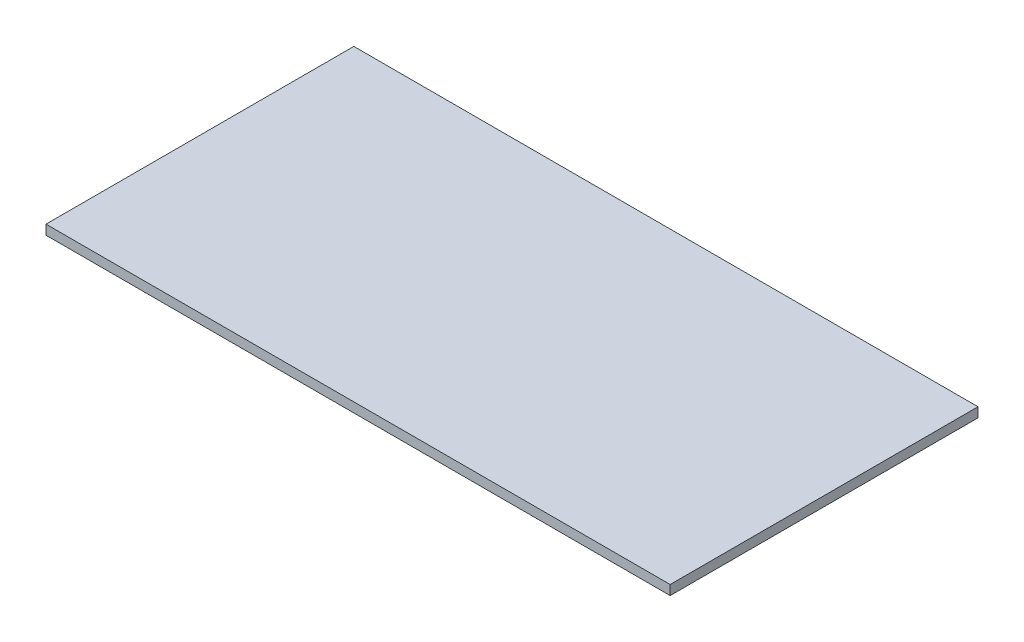
from build123d import *

# Parameters (mm, degrees)
SKETCH1_W           = 309
SKETCH1_H           = 152.4
BOSS_EXTRUDE2_DEPTH = 4.7625


with BuildPart() as part:
    # Sketch1 → Boss-Extrude2 (new body)
    with BuildSketch(Plane(origin=(0, 0, 0), x_dir=(1, 0, 0), z_dir=(0, 1, 0))):
        with Locations((95.371051813, 47.799481579)):
            Rectangle(SKETCH1_W, SKETCH1_H)
    extrude(amount=BOSS_EXTRUDE2_DEPTH)


solid = part.part
